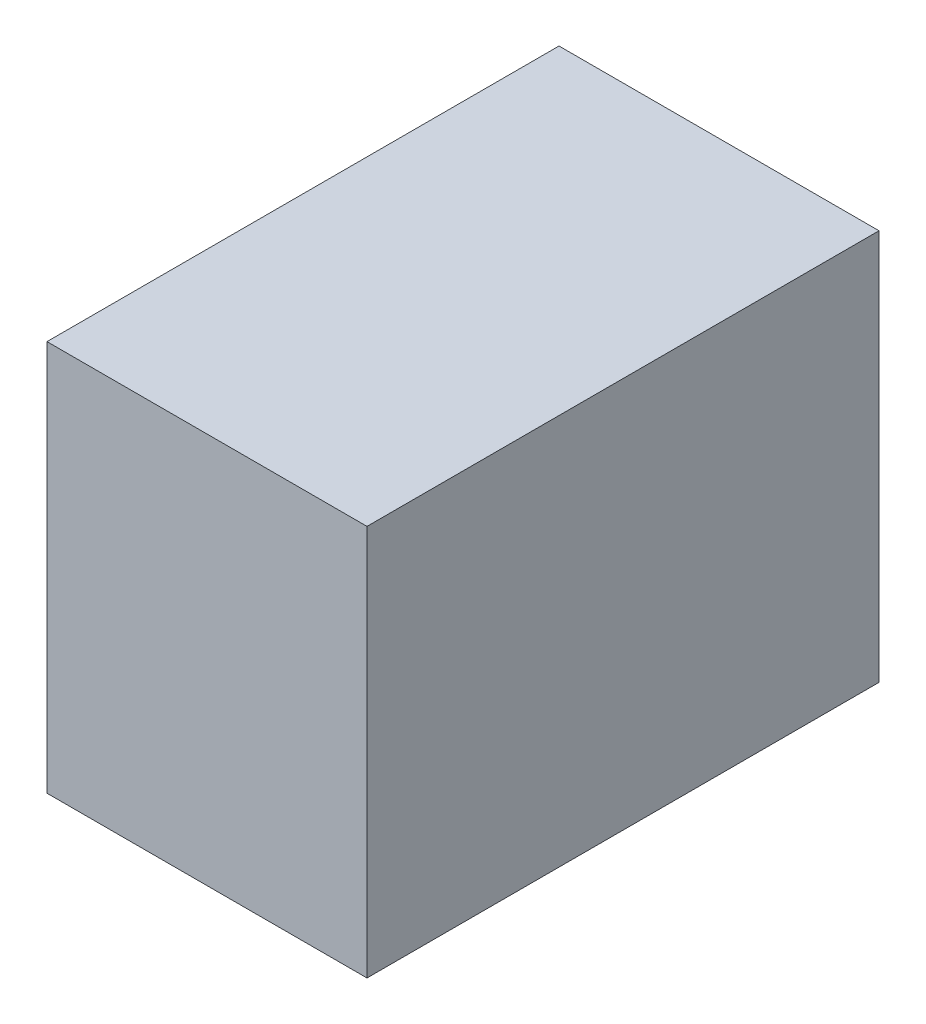
from build123d import *

# Parameters (mm, degrees)
SKETCH_1_W                               = 9
SKETCH_1_H                               = 11
SKETCH_1_R                               = 3.25
PJ002BH_9X11_FRONT_9P5MM_INSERTION_DEPTH = 9.5
JACK_REAR_BODY_14P4MM_TOTAL_START        = 9.5
SKETCH_2_W                               = 9
SKETCH_2_H                               = 11
JACK_REAR_BODY_14P4MM_TOTAL_DEPTH        = 4.9
SKETCH_3_R                               = 1.25
F_2P5MM_CENTRE_PIN_DEPTH                 = 9.5


with BuildPart() as part:
    # 草图1 → PJ002BH_9x11_front_9p5mm_insertion (new body)
    with BuildSketch(Plane.XY):
        with Locations((36.216, 32.1)):
            Rectangle(SKETCH_1_W, SKETCH_1_H)
        with Locations((36.216, 33.1)):
            Circle(SKETCH_1_R, mode=Mode.SUBTRACT)
    extrude(amount=PJ002BH_9X11_FRONT_9P5MM_INSERTION_DEPTH)

    # 草图2 → Jack_rear_body_14p4mm_total (add)
    with BuildSketch(Plane.XY.offset(JACK_REAR_BODY_14P4MM_TOTAL_START)):
        with Locations((36.216, 32.1)):
            Rectangle(SKETCH_2_W, SKETCH_2_H)
    extrude(amount=JACK_REAR_BODY_14P4MM_TOTAL_DEPTH)

    # 草图3 → 2p5mm_centre_pin (add)
    with BuildSketch(Plane.XY):
        with Locations((36.216, 33.1)):
            Circle(SKETCH_3_R)
    extrude(amount=F_2P5MM_CENTRE_PIN_DEPTH)


solid = part.part
